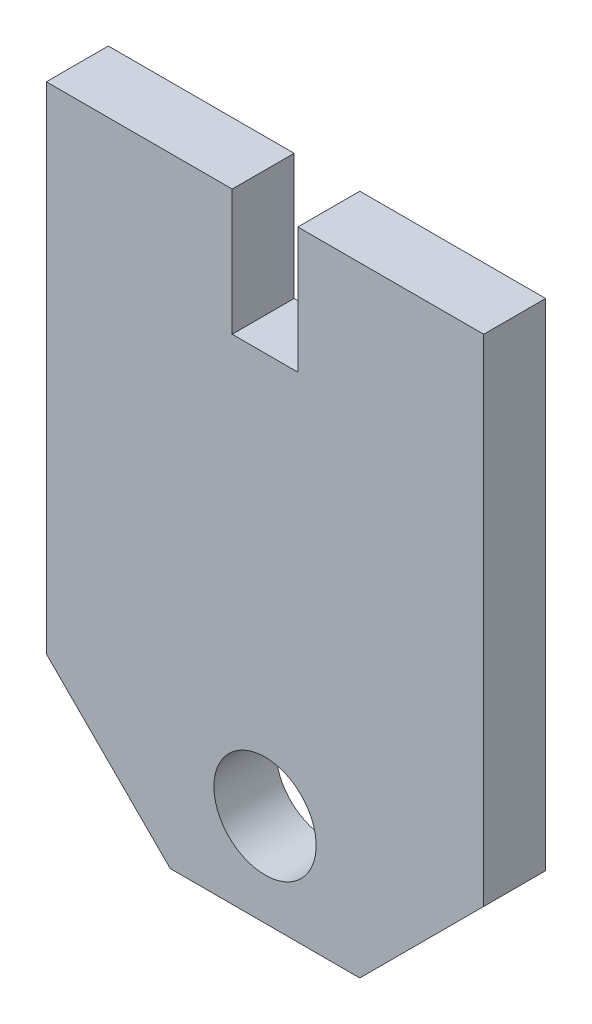
from build123d import *

# Parameters (mm, degrees)
SKETCH2_R           = 8.25
BOSS_EXTRUDE1_DEPTH = 5


with BuildPart() as part:
    # Sketch2 → Boss-Extrude1 (new, symmetric)
    with BuildSketch(Plane.XY.offset(-25)):
        Polygon((227.33813101, -85), (237.93813101, -85), (237.93813101, -64.7), (267.93813101, -64.7), (267.93813101, -144.7), (247.93813101, -164.7), (217.33813101, -164.7), (197.33813101, -144.7), (197.33813101, -64.7), (227.33813101, -64.7), align=None)
        with Locations(Location((232.63813101, -149.7, 0), (0, 0, 180))):
            Circle(SKETCH2_R, mode=Mode.SUBTRACT)
    extrude(amount=BOSS_EXTRUDE1_DEPTH, both=True)


solid = part.part
